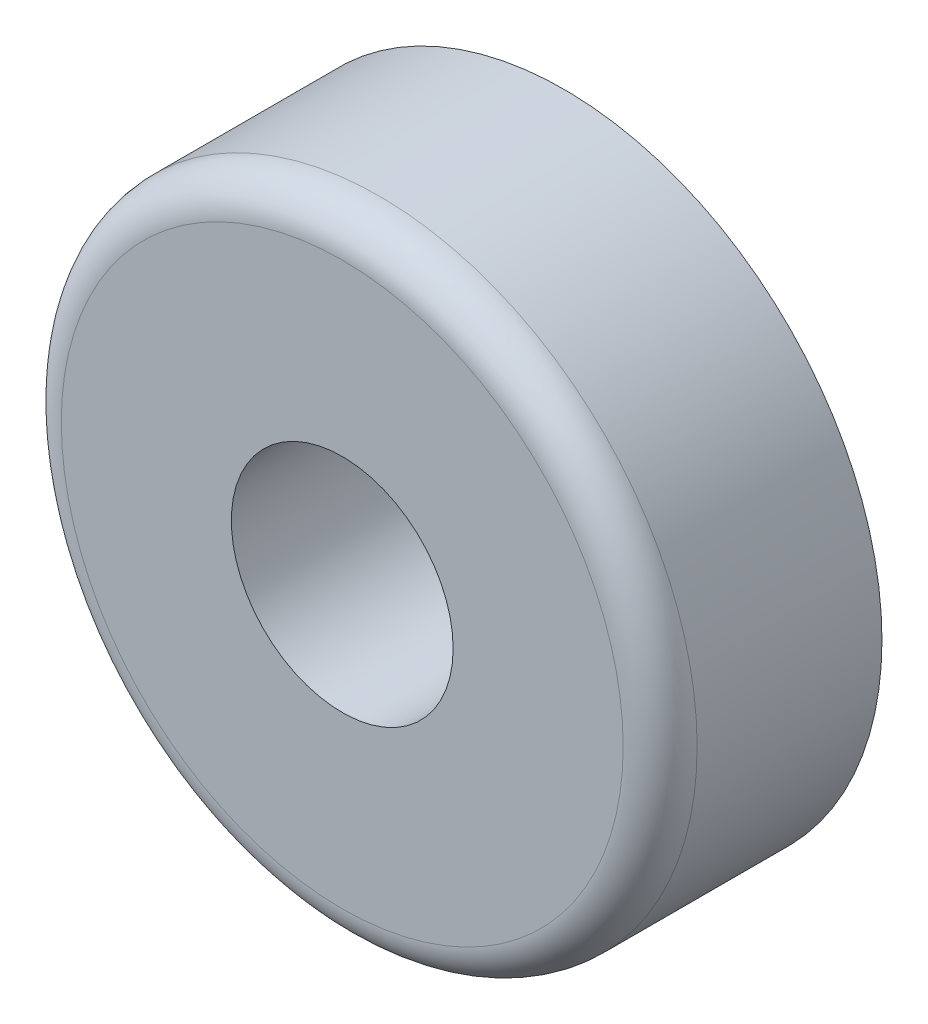
from build123d import *

# Parameters (mm, degrees)
SKETCH1_R           = 4.3
SKETCH1_R_2         = 1.5
BOSS_EXTRUDE1_DEPTH = 3
FILLET1_R           = 0.5


with BuildPart() as part:
    # Sketch1 → Boss-Extrude1 (new body)
    with BuildSketch(Plane.XY):
        Circle(SKETCH1_R)
        Circle(SKETCH1_R_2, mode=Mode.SUBTRACT)
    extrude(amount=BOSS_EXTRUDE1_DEPTH)

    # Fillet1
    fillet1_edges = [part.edges().sort_by_distance(p)[0] for p in [
        (-4.3, 0, 3),
    ]]
    fillet(fillet1_edges, radius=FILLET1_R)


solid = part.part
